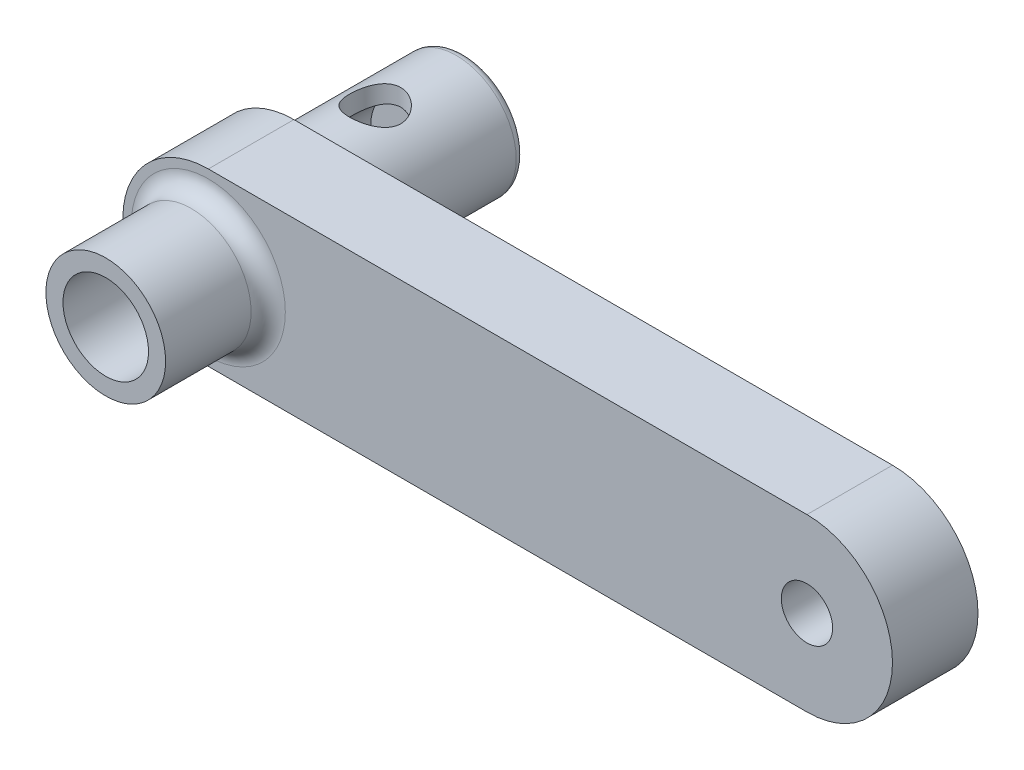
from build123d import *

# Parameters (mm, degrees)
ESQUISSE1_R                  = 2.5
ESQUISSE1_R_2                = 1.5
BOSS_EXTRU_1_DEPTH           = 5
BOSS_EXTRU_2_START           = -15
ESQUISSE2_R                  = 3.5
ESQUISSE2_R_2                = 2.5
BOSS_EXTRU_2_DEPTH           = 10
ESQUISSE3_R                  = 3.5
BOSS_EXTRU_3_DEPTH           = 3
CONG_1_R                     = 0.5
ENL_V_MAT_EXTRU_1_DEPTH      = 26.124689053
ENL_V_MAT_EXTRU_1_DEPTH_BACK = 26.124689053
ESQUISSE4_R                  = 1.5
ESQUISSE5_R                  = 3.5
ESQUISSE5_R_2                = 2.5
BOSS_EXTRU_4_DEPTH           = 6
CONG_2_R                     = 1
CONG_3_R                     = 1


with BuildPart() as part:
    # Esquisse1 → Boss.-Extru.1 (new body)
    with BuildSketch(Plane.XY):
        with BuildLine():
            Line((-17.5, 5), (17.5, 5))
            ThreePointArc((17.5, 5), (22.5, 0), (17.5, -5))
            Line((17.5, -5), (-17.5, -5))
            ThreePointArc((-17.5, -5), (-22.5, 0), (-17.5, 5))
        make_face()
        with Locations((-17.5, 0)):
            Circle(ESQUISSE1_R, mode=Mode.SUBTRACT)
        with Locations((17.5, 0)):
            Circle(ESQUISSE1_R_2, mode=Mode.SUBTRACT)
    extrude(amount=BOSS_EXTRU_1_DEPTH)

    # Esquisse2 → Boss.-Extru.2 (add)
    with BuildSketch(Plane.XY.offset(5).offset(BOSS_EXTRU_2_START)):
        with Locations((-17.5, 0)):
            Circle(ESQUISSE2_R)
        with Locations((-17.5, 0)):
            Circle(ESQUISSE2_R_2, mode=Mode.SUBTRACT)
    extrude(amount=BOSS_EXTRU_2_DEPTH)

    # Esquisse3 → Boss.-Extru.3 (add)
    with BuildSketch(Plane(origin=(0, 0, -10), x_dir=(-1, 0, 0), z_dir=(0, 0, -1))):
        with Locations(Location((17.5, 0, 0), (0, 0, 180))):
            Circle(ESQUISSE3_R)
    extrude(amount=-BOSS_EXTRU_3_DEPTH)

    # Congé1
    cong_1_edges = [part.edges().sort_by_distance(p)[0] for p in [
        (-21, 0, -10),
    ]]
    fillet(cong_1_edges, radius=CONG_1_R)

    # Esquisse4 → Enlèv. mat.-Extru.1 (cut, two sides: drawn at the far end of the back side and taken through both)
    with BuildSketch(Plane(origin=(0, 0, 0), x_dir=(1, 0, 0), z_dir=(0, 1, 0)).offset(-ENL_V_MAT_EXTRU_1_DEPTH_BACK)):
        with Locations(Location((-17.5, 4.75, 0), (0, 0, 270))):
            Circle(ESQUISSE4_R)
    extrude(amount=ENL_V_MAT_EXTRU_1_DEPTH + ENL_V_MAT_EXTRU_1_DEPTH_BACK, mode=Mode.SUBTRACT)

    # Esquisse5 → Boss.-Extru.4 (add)
    with BuildSketch(Plane.XY.offset(5)):
        with Locations((-17.5, 0)):
            Circle(ESQUISSE5_R)
        with Locations(Location((-17.5, 0, 0), (0, 0, 180))):
            Circle(ESQUISSE5_R_2, mode=Mode.SUBTRACT)
    extrude(amount=BOSS_EXTRU_4_DEPTH)

    # Congé2
    cong_2_edges = [part.edges().sort_by_distance(p)[0] for p in [
        (-21, 0, 5),
    ]]
    fillet(cong_2_edges, radius=CONG_2_R)

    # Congé3
    cong_3_edges = [part.edges().sort_by_distance(p)[0] for p in [
        (-21, 0, 0),
    ]]
    fillet(cong_3_edges, radius=CONG_3_R)


solid = part.part
